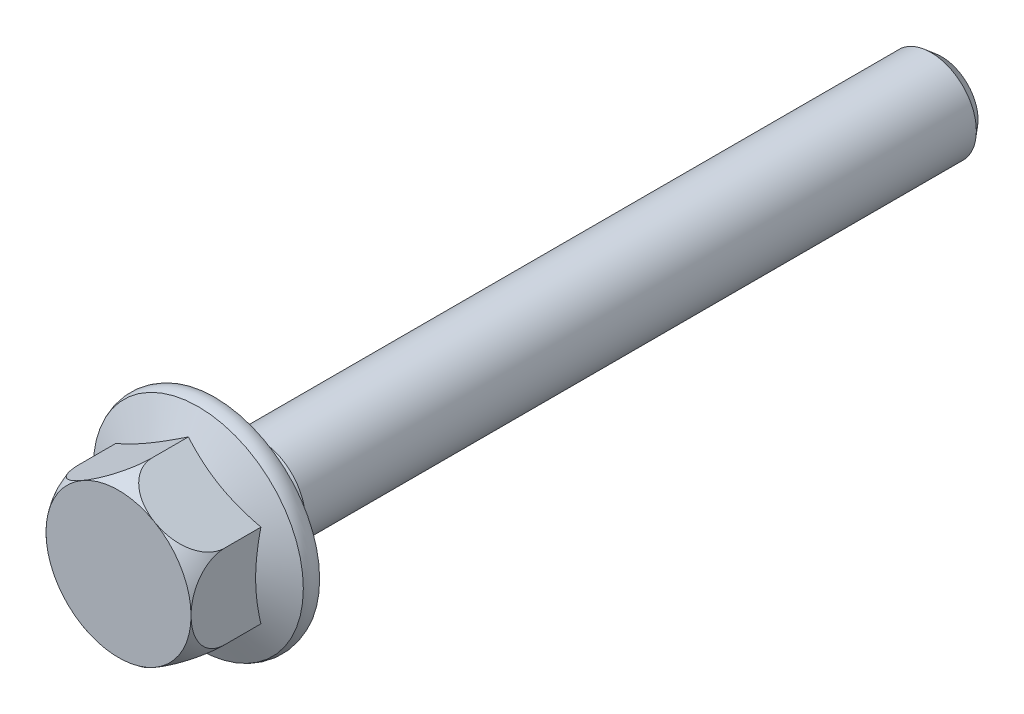
from build123d import *

# Parameters (mm, degrees)
HEAD_BOSS_EXTRUDE1_DEPTH   = 5.4
SKETCH11_R                 = 2.5
LENGTH_BOSS_EXTRUDE2_DEPTH = 40


with BuildPart() as part:
    # Sketch8 → head-Boss-Extrude1 (new body)
    with BuildSketch(Plane.XY):
        Polygon((0, 4.618802154), (-4, 2.309401077), (-4, -2.309401077), (0, -4.618802154), (4, -2.309401077), (4, 2.309401077), align=None)
    extrude(amount=HEAD_BOSS_EXTRUDE1_DEPTH)

    # Sketch9 → k'-Cut-Revolve1 (revolve, cut)
    with BuildSketch(Plane(origin=(0, 0, 0), x_dir=(0, 0, -1), z_dir=(1, 0, 0))):
        with BuildLine():
            Line((-5.4, 4.618802154), (-5.4, 4))
            ThreePointArc((-5.4, 4), (-4.524086001, 4.460011199), (-3.547550763, 4.618802154))
            Line((-3.547550763, 4.618802154), (-5.4, 4.618802154))
        make_face()
    revolve(axis=Axis((0, 0, 0), (0, 0, 1)), mode=Mode.SUBTRACT)

    # Sketch10 → flange-Revolve1 (revolve)
    with BuildSketch(Plane(origin=(0, 0, 0), x_dir=(0, 0, -1), z_dir=(1, 0, 0))):
        with BuildLine():
            Line((-1, 5.793028555), (-2.535564434, 2.5))
            Line((-2.535564434, 2.5), (0, 2.5))
            Line((0, 2.5), (0, 4.9))
            ThreePointArc((0, 4.9), (-0.025077882, 5.349305019), (-0.1, 5.793028555))
            ThreePointArc((-0.1, 5.793028555), (-0.55, 5.9), (-1, 5.793028555))
        make_face()
    revolve(axis=Axis((0, 0, 0), (0, 0, 1)))

    # Sketch11 → length-Boss-Extrude2 (add)
    with BuildSketch(Plane.XY):
        Circle(SKETCH11_R)
    extrude(amount=-LENGTH_BOSS_EXTRUDE2_DEPTH)

    # Sketch12 → thread-Cut-Revolve3 (revolve, cut)
    with BuildSketch(Plane(origin=(0, 0, 0), x_dir=(0, 0, -1), z_dir=(1, 0, 0)), mode=Mode.PRIVATE) as thread_cut_revolve3_sk:
        Polygon((1.6, 2.24), (0, 2.24), (0, 2.5), (2.4, 2.5), align=None)
    revolve(thread_cut_revolve3_sk.sketch.rotate(Axis((0, 0, 0), (0, 0, -1)), 90), axis=Axis((0, 0, 0), (0, 0, -1)), mode=Mode.SUBTRACT)

    # Sketch13 → chamfer-Cut-Revolve4 (revolve, cut)
    with BuildSketch(Plane(origin=(0, 0, 0), x_dir=(0, 0, -1), z_dir=(1, 0, 0))):
        Polygon((40, 2.0095), (40, 2.5), (39.415444863, 2.5), align=None)
    revolve(axis=Axis((0, 0, -40), (0, 0, 1)), mode=Mode.SUBTRACT)

    # Sketch15 → coarse-fillet-Revolve2 (revolve)
    with BuildSketch(Plane(origin=(0, 0, 0), x_dir=(0, 0, -1), z_dir=(1, 0, 0)), mode=Mode.PRIVATE) as coarse_fillet_revolve2_sk:
        with BuildLine():
            Line((0, 2.24), (1.4, 2.24))
            ThreePointArc((1.4, 2.24), (0.77257354, 2.31741069), (0.182777402, 2.545))
            ThreePointArc((0.182777402, 2.545), (0.049192715, 2.672213204), (0, 2.85))
            Line((0, 2.85), (0, 2.24))
        make_face()
    revolve(coarse_fillet_revolve2_sk.sketch.rotate(Axis((0, 0, -40), (0, 0, 1)), 90), axis=Axis((0, 0, -40), (0, 0, 1)))


solid = part.part
